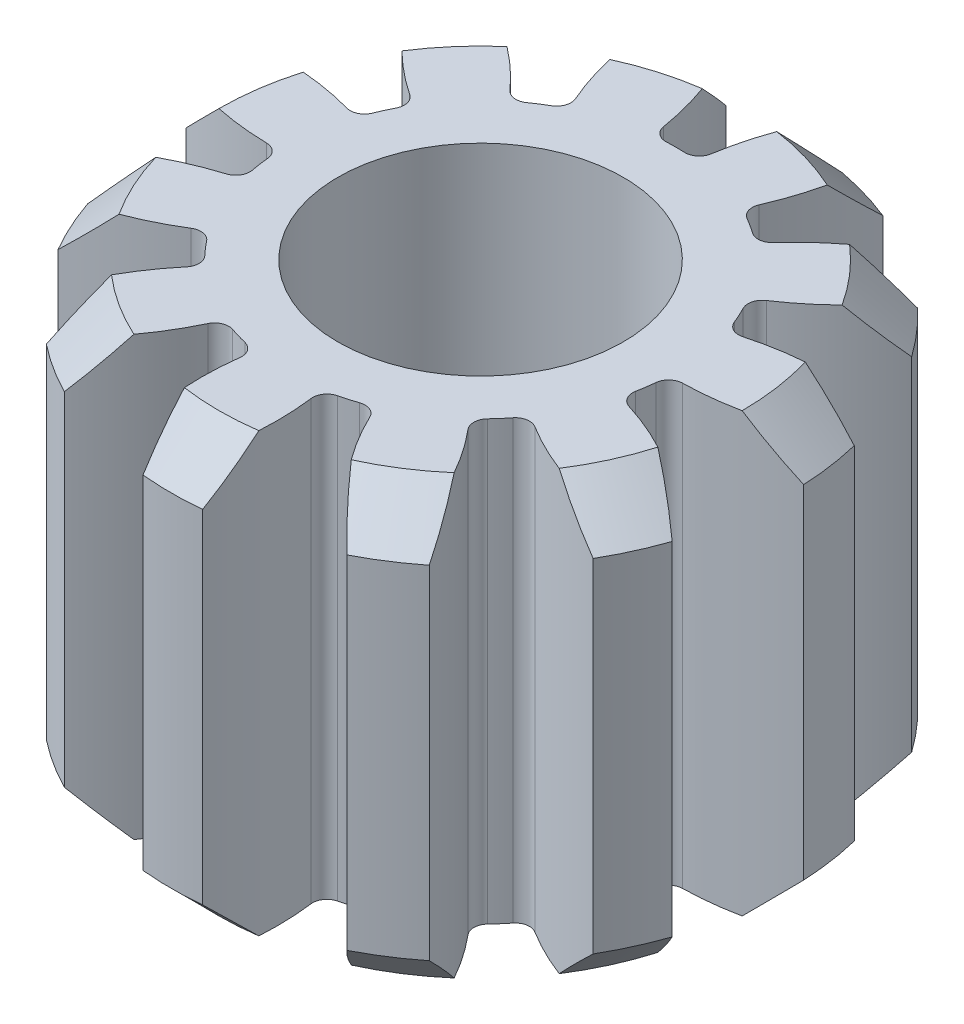
from build123d import *

# Parameters (mm, degrees)
SKETCH1_R                = 1.625
BOSS_EXTRUDE1_DEPTH      = 2.3
CUT_EXTRUDE1_DEPTH       = 4.251345875
FILLET1_R                = 0.075
CHAMFER1_SIZE            = 0.25
CIRPATTERN2_COUNT        = 11
FILLET1_OF_CIRPATTERN2_R = 0.075
SKETCH3_R                = 0.75
CUT_EXTRUDE2_DEPTH       = 4.250481236


with BuildPart() as part:
    # Sketch1 → Boss-Extrude1 (new body)
    with BuildSketch(Plane(origin=(0, 0, 0), x_dir=(1, 0, 0), z_dir=(0, 1, 0))):
        with Locations(Location((0, 0, 0), (0, 0, 270))):
            Circle(SKETCH1_R)
    extrude(amount=BOSS_EXTRUDE1_DEPTH)

    # Sketch2 → Cut-Extrude1 (cut, through all)
    with BuildSketch(Plane(origin=(0, 2.3, 0), x_dir=(1, 0, 0), z_dir=(0, 1, 0))):
        with BuildLine():
            ThreePointArc((-0.115185902, 1.018507343), (-0.180466304, 1.317079011), (-0.305237626, 1.59607487))
            ThreePointArc((-0.305237626, 1.59607487), (0, 1.625), (0.305237626, 1.59607487))
            ThreePointArc((0.305237626, 1.59607487), (0.180466304, 1.317079011), (0.115185902, 1.018507343))
            ThreePointArc((0.115185902, 1.018507343), (0, 1.025), (-0.115185902, 1.018507343))
        make_face()
    cut_extrude1 = extrude(amount=-CUT_EXTRUDE1_DEPTH, mode=Mode.SUBTRACT)

    # Fillet1
    fillet1_edges = [part.edges().sort_by_distance(p)[0] for p in [
        (0.115185902, 1.15, -1.018507343),
        (-0.115185902, 1.15, -1.018507343),
    ]]
    fillet(fillet1_edges, radius=FILLET1_R)

    # Chamfer1
    chamfer1_edges = [part.edges().sort_by_distance(p)[0] for p in [
        (0, 0, 1.625),
        (0, 2.3, 1.625),
    ]]
    chamfer(chamfer1_edges, length=CHAMFER1_SIZE)

    # CirPattern2: Cut-Extrude1 ×11 about axis
    cirpattern2_axis = Axis((0, 0, 0), (0, 1, 0))
    for i in range(1, CIRPATTERN2_COUNT):
        add(cut_extrude1.rotate(cirpattern2_axis, i * 360 / CIRPATTERN2_COUNT), mode=Mode.SUBTRACT)

    # Fillet1 of CirPattern2
    fillet1_of_cirpattern2_edges = [part.edges().sort_by_distance(p)[0] for p in [
        (-0.453746096, 1.15, -0.919097101),
        (-0.647547189, 1.15, -0.794548701),
        (-0.878616914, 1.15, -0.527880023),
        (-0.97431682, 1.15, -0.31832646),
        (-1.02453307, 1.15, 0.030935233),
        (-0.991747744, 1.15, 0.258962183),
        (-0.845167215, 1.15, 0.57992877),
        (-0.694305767, 1.15, 0.754032162),
        (-0.397466741, 1.15, 0.944799021),
        (-0.176426615, 1.15, 1.009702258),
        (0.176426615, 1.15, 1.009702258),
        (0.397466741, 1.15, 0.944799021),
        (0.694305767, 1.15, 0.754032162),
        (0.845167215, 1.15, 0.57992877),
        (0.991747744, 1.15, 0.258962183),
        (1.02453307, 1.15, 0.030935233),
        (0.97431682, 1.15, -0.31832646),
        (0.878616914, 1.15, -0.527880023),
        (0.647547189, 1.15, -0.794548701),
        (0.453746096, 1.15, -0.919097101),
    ]]
    fillet(fillet1_of_cirpattern2_edges, radius=FILLET1_OF_CIRPATTERN2_R)

    # Sketch3 → Cut-Extrude2 (cut, through all)
    with BuildSketch(Plane(origin=(0, 2.3, 0), x_dir=(1, 0, 0), z_dir=(0, 1, 0))):
        with Locations(Location((0, 0, 0), (0, 0, 270))):
            Circle(SKETCH3_R)
    extrude(amount=-CUT_EXTRUDE2_DEPTH, mode=Mode.SUBTRACT)


solid = part.part
